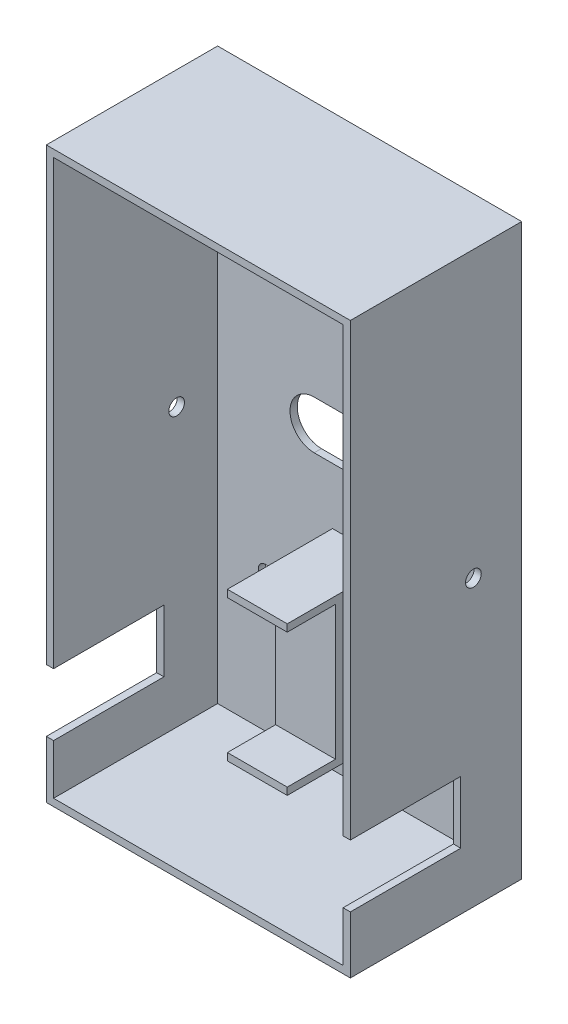
from build123d import *

# Parameters (mm, degrees)
SKETCH1_W                  = 63
SKETCH1_H                  = 118
BOSS_EXTRUDE1_DEPTH        = 35.5
SKETCH2_W                  = 60
SKETCH2_H                  = 115
CUT_EXTRUDE1_DEPTH         = 34
SKETCH3_W                  = 12.4
SKETCH3_H                  = 30.8
BOSS_EXTRUDE2_DEPTH        = 21.78
CUT_EXTRUDE2_REACH         = 129.081
SKETCH4_W                  = 10
SKETCH4_H                  = 27.8
CUT_EXTRUDE3_REACH         = 138.738
SKETCH5_W                  = 22.87
SKETCH5_H                  = 12.89
CUT_EXTRUDE4_REACH         = 138.738
SKETCH6_W                  = 22.87
SKETCH6_H                  = 12.89
CUT_EXTRUDE5_DEPTH         = 137.435882377
M2_5_CLEARANCE_HOLE1_D     = 3.05
M2_5_CLEARANCE_HOLE1_DEPTH = 35.5
M3_CLEARANCE_HOLE1_D       = 3.2512
M3_CLEARANCE_HOLE1_DEPTH   = 1.5
M3_CLEARANCE_HOLE2_D       = 3.2512
M3_CLEARANCE_HOLE2_DEPTH   = 63


with BuildPart() as part:
    # Sketch1 → Boss-Extrude1 (new body)
    with BuildSketch(Plane.XY.offset(34)):
        with Locations((30, 57.5)):
            Rectangle(SKETCH1_W, SKETCH1_H)
    extrude(amount=-BOSS_EXTRUDE1_DEPTH)

    # Sketch2 → Cut-Extrude1 (cut)
    with BuildSketch(Plane.XY.offset(34)):
        with Locations((30, 57.5)):
            Rectangle(SKETCH2_W, SKETCH2_H)
    extrude(amount=-CUT_EXTRUDE1_DEPTH, mode=Mode.SUBTRACT)

    # Sketch3 → Boss-Extrude2 (add)
    with BuildSketch(Plane.XY):
        with Locations((30, 27.9)):
            Rectangle(SKETCH3_W, SKETCH3_H)
    extrude(amount=BOSS_EXTRUDE2_DEPTH)

    # Sketch4 → Cut-Extrude2 (cut, up to next)
    with BuildSketch(Plane.ZY.offset(-23.8), mode=Mode.PRIVATE) as cut_extrude2_sk1:
        with Locations((16.78, 27.9)):
            Rectangle(SKETCH4_W, SKETCH4_H)
    cut_extrude2_tool1 = extrude(cut_extrude2_sk1.sketch, amount=-CUT_EXTRUDE2_REACH, mode=Mode.PRIVATE) & part.part
    add(cut_extrude2_tool1.solids().sort_by_distance((23.8, 27.9, 16.78))[0], mode=Mode.SUBTRACT)

    # Sketch5 → Cut-Extrude3 (cut, up to next)
    with BuildSketch(Plane(origin=(61.5, 0, 0), x_dir=(0, 0, -1), z_dir=(1, 0, 0)), mode=Mode.PRIVATE) as cut_extrude3_sk1:
        with Locations((-22.565, 16.805)):
            Rectangle(SKETCH5_W, SKETCH5_H)
    cut_extrude3_tool1 = extrude(cut_extrude3_sk1.sketch, amount=-CUT_EXTRUDE3_REACH, mode=Mode.PRIVATE) & part.part
    add(cut_extrude3_tool1.solids().sort_by_distance((61.5, 16.805, 22.565))[0], mode=Mode.SUBTRACT)

    # Sketch6 → Cut-Extrude4 (cut, up to next)
    with BuildSketch(Plane.ZY.offset(1.5), mode=Mode.PRIVATE) as cut_extrude4_sk1:
        with Locations((22.565, 16.805)):
            Rectangle(SKETCH6_W, SKETCH6_H)
    cut_extrude4_tool1 = extrude(cut_extrude4_sk1.sketch, amount=-CUT_EXTRUDE4_REACH, mode=Mode.PRIVATE) & part.part
    add(cut_extrude4_tool1.solids().sort_by_distance((-1.5, 16.805, 22.565))[0], mode=Mode.SUBTRACT)

    # Sketch7 → Cut-Extrude5 (cut, through all)
    with BuildSketch(Plane(origin=(0, 0, -1.5), x_dir=(-1, 0, 0), z_dir=(0, 0, -1))):
        with BuildLine():
            Line((-40, 55), (-20, 55))
            ThreePointArc((-20, 55), (-15, 60), (-20, 65))
            Line((-20, 65), (-40, 65))
            ThreePointArc((-40, 65), (-45, 60), (-40, 55))
        make_face()
    extrude(amount=-CUT_EXTRUDE5_DEPTH, mode=Mode.SUBTRACT)

    # M2.5 Clearance Hole1
    with Locations(Plane(origin=(0, 0, -1.5), x_dir=(-1, 0, 0), z_dir=(0, 0, -1))):
        with Locations((-9.95, 28.42), (-9.95, 21.935), (-50.05, 28.42), (-50.05, 21.935)):
            Hole(M2_5_CLEARANCE_HOLE1_D / 2, depth=M2_5_CLEARANCE_HOLE1_DEPTH)

    # M3 Clearance Hole1
    with Locations(Plane(origin=(0, 0, 0), x_dir=(0, 0, -1), z_dir=(1, 0, 0))):
        with Locations((-8.5, 57.5)):
            Hole(M3_CLEARANCE_HOLE1_D / 2, depth=M3_CLEARANCE_HOLE1_DEPTH)

    # M3 Clearance Hole2
    with Locations(Plane(origin=(61.5, 0, 0), x_dir=(0, 0, -1), z_dir=(1, 0, 0))):
        with Locations((-8.5, 57.5)):
            Hole(M3_CLEARANCE_HOLE2_D / 2, depth=M3_CLEARANCE_HOLE2_DEPTH)


solid = part.part
